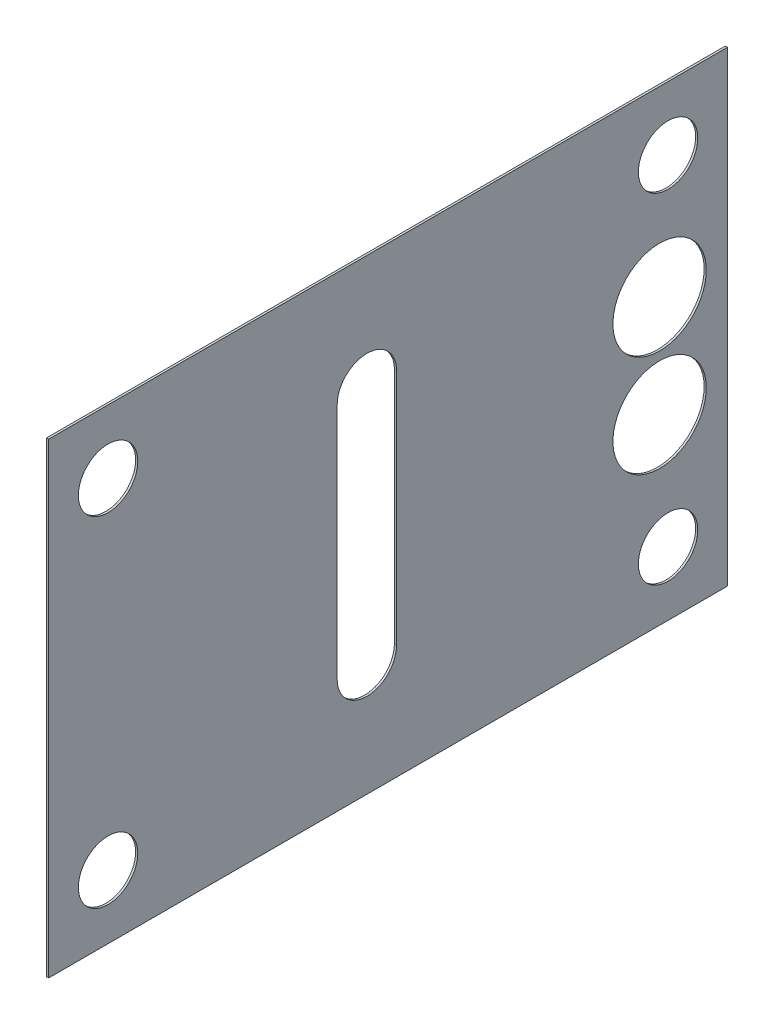
from build123d import *

# Parameters (mm, degrees)
SKETCH1_W             = 160
SKETCH1_H             = 110
BOSS_EXTRUDE1_DEPTH   = 0.508
M12_CLEARANCE_HOLE1_D = 14
CUT_EXTRUDE1_DEPTH    = 98.083768283
M20_CLEARANCE_HOLE1_D = 22


with BuildPart() as part:
    # Sketch1 → Boss-Extrude1 (new body)
    with BuildSketch(Plane(origin=(0, 0, 0), x_dir=(0, 0, -1), z_dir=(1, 0, 0))):
        Rectangle(SKETCH1_W, SKETCH1_H)
    extrude(amount=BOSS_EXTRUDE1_DEPTH)

    # M12 Clearance Hole1 (through all)
    with Locations(Plane(origin=(0.508, 0, 0), x_dir=(0, 0, -1), z_dir=(1, 0, 0))):
        with Locations((-66, 40), (66, 40), (66, -40), (-66, -40)):
            Hole(M12_CLEARANCE_HOLE1_D / 2)

    # Sketch4 → Cut-Extrude1 (cut, through all)
    with BuildSketch(Plane(origin=(0.508, 0, 0), x_dir=(0, 0, -1), z_dir=(1, 0, 0))):
        with BuildLine():
            Line((2, 28), (2, -28))
            ThreePointArc((2, -28), (-5, -35), (-12, -28))
            Line((-12, -28), (-12, 28))
            ThreePointArc((-12, 28), (-5, 35), (2, 28))
        make_face()
    extrude(amount=-CUT_EXTRUDE1_DEPTH, mode=Mode.SUBTRACT)

    # M20 Clearance Hole1 (through all)
    with Locations(Plane(origin=(0.508, 0, 0), x_dir=(0, 0, -1), z_dir=(1, 0, 0))):
        with Locations((64, 12), (64, -12)):
            Hole(M20_CLEARANCE_HOLE1_D / 2)


solid = part.part
